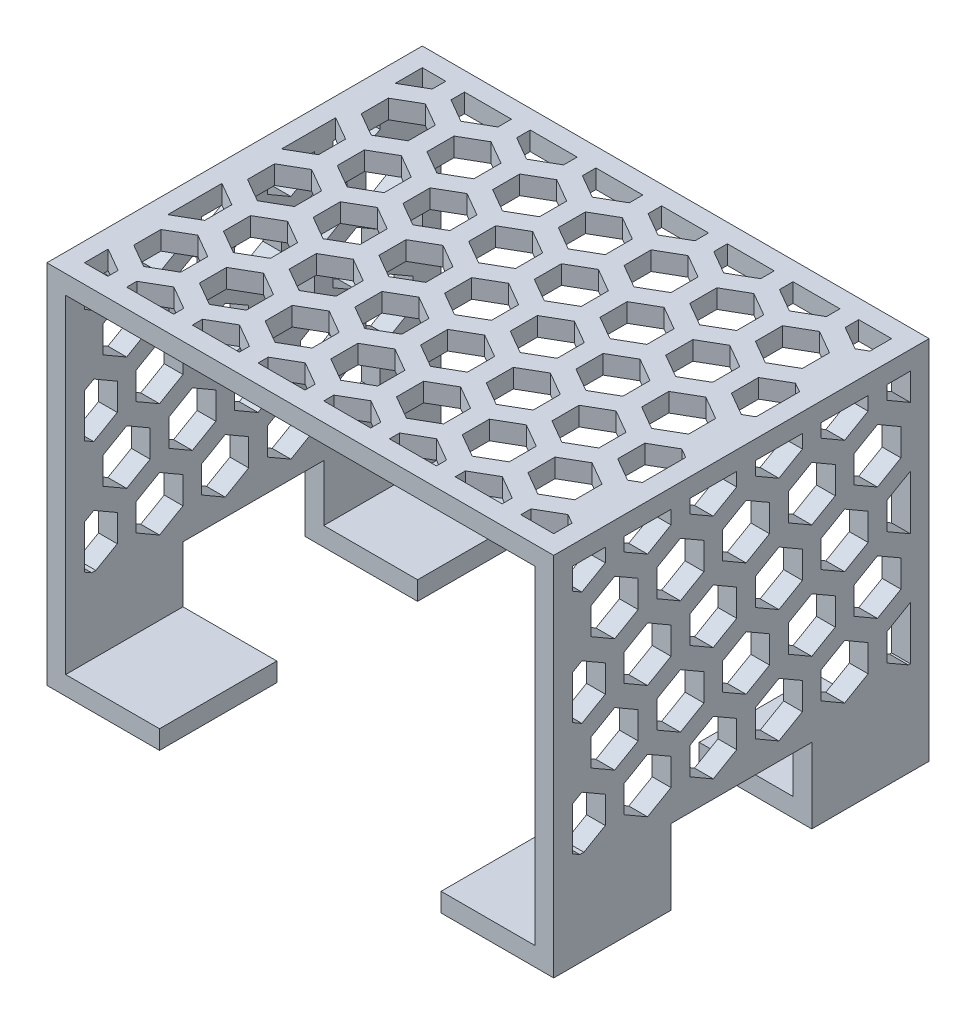
from build123d import *

# Parameters (mm, degrees)
EXTRUDE_1_DEPTH     = 40
CUT_EXTRUDE_1_DEPTH = 2
SKETCH_3_W          = 15
SKETCH_3_H          = 8
CUT_EXTRUDE_2_DEPTH = 74
CUT_EXTRUDE_3_DEPTH = 74


with BuildPart() as part:
    # 草图1 → 凸台-拉伸1 (new body)
    with BuildSketch(Plane.XY):
        Polygon((16.787564767, -12.506028744), (16.787564767, -10.506028744), (26.787564767, -10.506028744), (26.787564767, 24.493971256), (-23.212435233, 24.493971256), (-23.212435233, -10.506028744), (-13.212435233, -10.506028744), (-13.212435233, -12.506028744), (-23.212435233, -12.506028744), (-25.212435233, -12.506028744), (-25.212435233, 22.493971256), (-25.212435233, 26.493971256), (28.787564767, 26.493971256), (28.787564767, 23.46806452), (28.787564767, -12.506028744), (26.787564767, -12.506028744), align=None)
    extrude(amount=EXTRUDE_1_DEPTH)

    # 草图2 → 切除-拉伸1 (cut)
    with BuildSketch(Plane(origin=(0, 26.493971256, 0), x_dir=(1, 0, 0), z_dir=(0, 1, 0))):
        Polygon((-19.712435233, -10.948929172), (-17.212435233, -9.505553499), (-17.212435233, -6.618802154), (-19.712435233, -5.175426481), (-22.212435233, -6.618802154), (-22.212435233, -9.505553499), align=None)
        Polygon((-23.212435233, -4.886751346), (-20.712435233, -3.443375673), (-20.712435233, -2), (-23.212435233, -2), align=None)
        Polygon((-16.212435233, -4.886751346), (-13.712435233, -3.443375673), (-13.712435233, -2), (-18.712435233, -2), (-18.712435233, -3.443375673), align=None)
        Polygon((-12.712435233, -10.948929172), (-10.212435233, -9.505553499), (-10.212435233, -6.618802154), (-12.712435233, -5.175426481), (-15.212435233, -6.618802154), (-15.212435233, -9.505553499), align=None)
        Polygon((-9.212435233, -4.886751346), (-6.712435233, -3.443375673), (-6.712435233, -2), (-11.712435233, -2), (-11.712435233, -3.443375673), align=None)
        Polygon((-5.712435233, -10.948929172), (-3.212435233, -9.505553499), (-3.212435233, -6.618802154), (-5.712435233, -5.175426481), (-8.212435233, -6.618802154), (-8.212435233, -9.505553499), align=None)
        Polygon((-2.212435233, -4.886751346), (0.287564767, -3.443375673), (0.287564767, -2), (-4.712435233, -2), (-4.712435233, -3.443375673), align=None)
        Polygon((1.287564767, -10.948929172), (3.787564767, -9.505553499), (3.787564767, -6.618802154), (1.287564767, -5.175426481), (-1.212435233, -6.618802154), (-1.212435233, -9.505553499), align=None)
        Polygon((4.787564767, -4.886751346), (7.287564767, -3.443375673), (7.287564767, -2), (2.287564767, -2), (2.287564767, -3.443375673), align=None)
        Polygon((8.287564767, -10.948929172), (10.787564767, -9.505553499), (10.787564767, -6.618802154), (8.287564767, -5.175426481), (5.787564767, -6.618802154), (5.787564767, -9.505553499), align=None)
        Polygon((11.787564767, -4.886751346), (14.287564767, -3.443375673), (14.287564767, -2), (9.287564767, -2), (9.287564767, -3.443375673), align=None)
        Polygon((15.287564767, -10.948929172), (17.787564767, -9.505553499), (17.787564767, -6.618802154), (15.287564767, -5.175426481), (12.787564767, -6.618802154), (12.787564767, -9.505553499), align=None)
        Polygon((18.787564767, -4.886751346), (21.287564767, -3.443375673), (21.287564767, -2), (16.287564767, -2), (16.287564767, -3.443375673), align=None)
        Polygon((22.287564767, -10.948929172), (24.787564767, -9.505553499), (24.787564767, -6.618802154), (22.287564767, -5.175426481), (19.787564767, -6.618802154), (19.787564767, -9.505553499), align=None)
        Polygon((25.787564767, -4.886751346), (26.787564767, -4.309401077), (26.787564767, -2), (23.287564767, -2), (23.287564767, -3.443375673), align=None)
        Polygon((-16.212435233, -17.006751346), (-13.712435233, -15.563375673), (-13.712435233, -12.676624327), (-16.212435233, -11.233248654), (-18.712435233, -12.676624327), (-18.712435233, -15.563375673), align=None)
        Polygon((-12.712435233, -23.068929172), (-10.212435233, -21.625553499), (-10.212435233, -18.738802154), (-12.712435233, -17.295426481), (-15.212435233, -18.738802154), (-15.212435233, -21.625553499), align=None)
        Polygon((-9.212435233, -17.006751346), (-6.712435233, -15.563375673), (-6.712435233, -12.676624327), (-9.212435233, -11.233248654), (-11.712435233, -12.676624327), (-11.712435233, -15.563375673), align=None)
        Polygon((-5.712435233, -23.068929172), (-3.212435233, -21.625553499), (-3.212435233, -18.738802154), (-5.712435233, -17.295426481), (-8.212435233, -18.738802154), (-8.212435233, -21.625553499), align=None)
        Polygon((-2.212435233, -17.006751346), (0.287564767, -15.563375673), (0.287564767, -12.676624327), (-2.212435233, -11.233248654), (-4.712435233, -12.676624327), (-4.712435233, -15.563375673), align=None)
        Polygon((1.287564767, -23.068929172), (3.787564767, -21.625553499), (3.787564767, -18.738802154), (1.287564767, -17.295426481), (-1.212435233, -18.738802154), (-1.212435233, -21.625553499), align=None)
        Polygon((4.787564767, -17.006751346), (7.287564767, -15.563375673), (7.287564767, -12.676624327), (4.787564767, -11.233248654), (2.287564767, -12.676624327), (2.287564767, -15.563375673), align=None)
        Polygon((8.287564767, -23.068929172), (10.787564767, -21.625553499), (10.787564767, -18.738802154), (8.287564767, -17.295426481), (5.787564767, -18.738802154), (5.787564767, -21.625553499), align=None)
        Polygon((11.787564767, -17.006751346), (14.287564767, -15.563375673), (14.287564767, -12.676624327), (11.787564767, -11.233248654), (9.287564767, -12.676624327), (9.287564767, -15.563375673), align=None)
        Polygon((15.287564767, -23.068929172), (17.787564767, -21.625553499), (17.787564767, -18.738802154), (15.287564767, -17.295426481), (12.787564767, -18.738802154), (12.787564767, -21.625553499), align=None)
        Polygon((18.787564767, -17.006751346), (21.287564767, -15.563375673), (21.287564767, -12.676624327), (18.787564767, -11.233248654), (16.287564767, -12.676624327), (16.287564767, -15.563375673), align=None)
        Polygon((22.287564767, -23.068929172), (24.787564767, -21.625553499), (24.787564767, -18.738802154), (22.287564767, -17.295426481), (19.787564767, -18.738802154), (19.787564767, -21.625553499), align=None)
        Polygon((25.787564767, -17.006751346), (26.787564767, -16.429401077), (26.787564767, -11.810598923), (25.787564767, -11.233248654), (23.287564767, -12.676624327), (23.287564767, -15.563375673), align=None)
        Polygon((-16.212435233, -29.126751346), (-13.712435233, -27.683375673), (-13.712435233, -24.796624327), (-16.212435233, -23.353248654), (-18.712435233, -24.796624327), (-18.712435233, -27.683375673), align=None)
        Polygon((-12.712435233, -35.188929172), (-10.212435233, -33.745553499), (-10.212435233, -30.858802154), (-12.712435233, -29.415426481), (-15.212435233, -30.858802154), (-15.212435233, -33.745553499), align=None)
        Polygon((-9.212435233, -29.126751346), (-6.712435233, -27.683375673), (-6.712435233, -24.796624327), (-9.212435233, -23.353248654), (-11.712435233, -24.796624327), (-11.712435233, -27.683375673), align=None)
        Polygon((-5.712435233, -35.188929172), (-3.212435233, -33.745553499), (-3.212435233, -30.858802154), (-5.712435233, -29.415426481), (-8.212435233, -30.858802154), (-8.212435233, -33.745553499), align=None)
        Polygon((-2.212435233, -29.126751346), (0.287564767, -27.683375673), (0.287564767, -24.796624327), (-2.212435233, -23.353248654), (-4.712435233, -24.796624327), (-4.712435233, -27.683375673), align=None)
        Polygon((1.287564767, -35.188929172), (3.787564767, -33.745553499), (3.787564767, -30.858802154), (1.287564767, -29.415426481), (-1.212435233, -30.858802154), (-1.212435233, -33.745553499), align=None)
        Polygon((4.787564767, -29.126751346), (7.287564767, -27.683375673), (7.287564767, -24.796624327), (4.787564767, -23.353248654), (2.287564767, -24.796624327), (2.287564767, -27.683375673), align=None)
        Polygon((8.287564767, -35.188929172), (10.787564767, -33.745553499), (10.787564767, -30.858802154), (8.287564767, -29.415426481), (5.787564767, -30.858802154), (5.787564767, -33.745553499), align=None)
        Polygon((11.787564767, -29.126751346), (14.287564767, -27.683375673), (14.287564767, -24.796624327), (11.787564767, -23.353248654), (9.287564767, -24.796624327), (9.287564767, -27.683375673), align=None)
        Polygon((15.287564767, -35.188929172), (17.787564767, -33.745553499), (17.787564767, -30.858802154), (15.287564767, -29.415426481), (12.787564767, -30.858802154), (12.787564767, -33.745553499), align=None)
        Polygon((18.787564767, -29.126751346), (21.287564767, -27.683375673), (21.287564767, -24.796624327), (18.787564767, -23.353248654), (16.287564767, -24.796624327), (16.287564767, -27.683375673), align=None)
        Polygon((22.287564767, -35.188929172), (24.787564767, -33.745553499), (24.787564767, -30.858802154), (22.287564767, -29.415426481), (19.787564767, -30.858802154), (19.787564767, -33.745553499), align=None)
        Polygon((25.787564767, -29.126751346), (26.787564767, -28.549401077), (26.787564767, -23.930598923), (25.787564767, -23.353248654), (23.287564767, -24.796624327), (23.287564767, -27.683375673), align=None)
        Polygon((-13.712435233, -38), (-13.712435233, -36.916624327), (-16.212435233, -35.473248654), (-18.712435233, -36.916624327), (-18.712435233, -38), align=None)
        Polygon((-6.712435233, -38), (-6.712435233, -36.916624327), (-9.212435233, -35.473248654), (-11.712435233, -36.916624327), (-11.712435233, -38), align=None)
        Polygon((0.287564767, -38), (0.287564767, -36.916624327), (-2.212435233, -35.473248654), (-4.712435233, -36.916624327), (-4.712435233, -38), align=None)
        Polygon((7.287564767, -38), (7.287564767, -36.916624327), (4.787564767, -35.473248654), (2.287564767, -36.916624327), (2.287564767, -38), align=None)
        Polygon((14.287564767, -38), (14.287564767, -36.916624327), (11.787564767, -35.473248654), (9.287564767, -36.916624327), (9.287564767, -38), align=None)
        Polygon((21.287564767, -38), (21.287564767, -36.916624327), (18.787564767, -35.473248654), (16.287564767, -36.916624327), (16.287564767, -38), align=None)
        Polygon((26.787564767, -36.050598923), (25.787564767, -35.473248654), (23.287564767, -36.916624327), (23.287564767, -38), (26.787564767, -38), align=None)
        Polygon((-23.212435233, -17.006751346), (-20.712435233, -15.563375673), (-20.712435233, -12.676624327), (-23.212435233, -11.233248654), align=None)
        Polygon((-19.712435233, -23.068929172), (-17.212435233, -21.625553499), (-17.212435233, -18.738802154), (-19.712435233, -17.295426481), (-22.212435233, -18.738802154), (-22.212435233, -21.625553499), align=None)
        Polygon((-23.212435233, -29.126751346), (-20.712435233, -27.683375673), (-20.712435233, -24.796624327), (-23.212435233, -23.353248654), align=None)
        Polygon((-19.712435233, -35.188929172), (-17.212435233, -33.745553499), (-17.212435233, -30.858802154), (-19.712435233, -29.415426481), (-22.212435233, -30.858802154), (-22.212435233, -33.745553499), align=None)
        Polygon((-20.712435233, -38), (-20.712435233, -36.916624327), (-23.212435233, -35.473248654), (-23.212435233, -38), align=None)
    extrude(amount=-CUT_EXTRUDE_1_DEPTH, mode=Mode.SUBTRACT)

    # 草图3 → 切除-拉伸2 (cut)
    with BuildSketch(Plane.ZY.offset(25.212435233)):
        with Locations((20, -8.506028744)):
            Rectangle(SKETCH_3_W, SKETCH_3_H)
    extrude(amount=-CUT_EXTRUDE_2_DEPTH, mode=Mode.SUBTRACT)

    # 草图4 → 切除-拉伸3 (cut)
    with BuildSketch(Plane.ZY.offset(25.212435233)):
        Polygon((2, 24.493971256), (2, 21.60721991), (4.5, 23.050595583), (4.5, 24.493971256), align=None)
        Polygon((8, 19.875169102), (5.5, 21.318544775), (3, 19.875169102), (3, 16.988417756), (5.5, 15.545042083), (8, 16.988417756), align=None)
        Polygon((11.5, 24.493971256), (6.5, 24.493971256), (6.5, 23.050595583), (9, 21.60721991), (11.5, 23.050595583), align=None)
        Polygon((15, 19.875169102), (12.5, 21.318544775), (10, 19.875169102), (10, 16.988417756), (12.5, 15.545042083), (15, 16.988417756), align=None)
        Polygon((18.5, 24.493971256), (13.5, 24.493971256), (13.5, 23.050595583), (16, 21.60721991), (18.5, 23.050595583), align=None)
        Polygon((22, 19.875169102), (19.5, 21.318544775), (17, 19.875169102), (17, 16.988417756), (19.5, 15.545042083), (22, 16.988417756), align=None)
        Polygon((25.5, 24.493971256), (20.5, 24.493971256), (20.5, 23.050595583), (23, 21.60721991), (25.5, 23.050595583), align=None)
        Polygon((29, 19.875169102), (26.5, 21.318544775), (24, 19.875169102), (24, 16.988417756), (26.5, 15.545042083), (29, 16.988417756), align=None)
        Polygon((32.5, 24.493971256), (27.5, 24.493971256), (27.5, 23.050595583), (30, 21.60721991), (32.5, 23.050595583), align=None)
        Polygon((36, 19.875169102), (33.5, 21.318544775), (31, 19.875169102), (31, 16.988417756), (33.5, 15.545042083), (36, 16.988417756), align=None)
        Polygon((38, 24.493971256), (34.5, 24.493971256), (34.5, 23.050595583), (37, 21.60721991), (38, 22.184570179), align=None)
        Polygon((11.5, 13.817346929), (9, 15.260722602), (6.5, 13.817346929), (6.5, 10.930595583), (9, 9.48721991), (11.5, 10.930595583), align=None)
        Polygon((15, 7.755169102), (12.5, 9.198544775), (10, 7.755169102), (10, 4.868417756), (12.5, 3.425042083), (15, 4.868417756), align=None)
        Polygon((18.5, 13.817346929), (16, 15.260722602), (13.5, 13.817346929), (13.5, 10.930595583), (16, 9.48721991), (18.5, 10.930595583), align=None)
        Polygon((22, 7.755169102), (19.5, 9.198544775), (17, 7.755169102), (17, 4.868417756), (19.5, 3.425042083), (22, 4.868417756), align=None)
        Polygon((25.5, 13.817346929), (23, 15.260722602), (20.5, 13.817346929), (20.5, 10.930595583), (23, 9.48721991), (25.5, 10.930595583), align=None)
        Polygon((29, 7.755169102), (26.5, 9.198544775), (24, 7.755169102), (24, 4.868417756), (26.5, 3.425042083), (29, 4.868417756), align=None)
        Polygon((32.5, 13.817346929), (30, 15.260722602), (27.5, 13.817346929), (27.5, 10.930595583), (30, 9.48721991), (32.5, 10.930595583), align=None)
        Polygon((36, 7.755169102), (33.5, 9.198544775), (31, 7.755169102), (31, 4.868417756), (33.5, 3.425042083), (36, 4.868417756), align=None)
        Polygon((38, 14.683372332), (37, 15.260722602), (34.5, 13.817346929), (34.5, 10.930595583), (37, 9.48721991), (38, 10.064570179), align=None)
        Polygon((11.5, 1.697346929), (9, 3.140722602), (6.5, 1.697346929), (6.5, -1.189404417), (9, -2.63278009), (11.5, -1.189404417), align=None)
        Polygon((18.5, 1.697346929), (16, 3.140722602), (13.5, 1.697346929), (13.5, -1.189404417), (16, -2.63278009), (18.5, -1.189404417), align=None)
        Polygon((25.5, 1.697346929), (23, 3.140722602), (20.5, 1.697346929), (20.5, -1.189404417), (23, -2.63278009), (25.5, -1.189404417), align=None)
        Polygon((32.5, 1.697346929), (30, 3.140722602), (27.5, 1.697346929), (27.5, -1.189404417), (30, -2.63278009), (32.5, -1.189404417), align=None)
        Polygon((38, 2.563372332), (37, 3.140722602), (34.5, 1.697346929), (34.5, -1.189404417), (36.780460229, -2.506028744), (37.219539771, -2.506028744), (38, -2.055429821), align=None)
        Polygon((2, 15.260722602), (2, 9.48721991), (4.5, 10.930595583), (4.5, 13.817346929), align=None)
        Polygon((8, 7.755169102), (5.5, 9.198544775), (3, 7.755169102), (3, 4.868417756), (5.5, 3.425042083), (8, 4.868417756), align=None)
        Polygon((2, -2.506028744), (2.219539771, -2.506028744), (4.5, -1.189404417), (4.5, 1.697346929), (2, 3.140722602), align=None)
    extrude(amount=-CUT_EXTRUDE_3_DEPTH, mode=Mode.SUBTRACT)


solid = part.part
